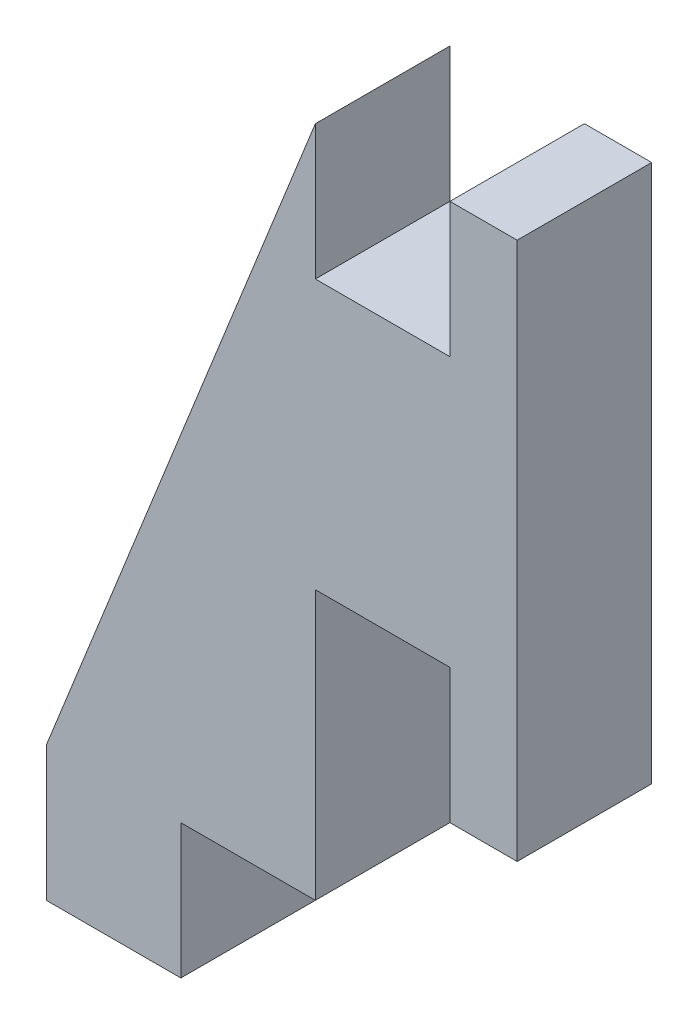
from build123d import *

# Parameters (mm, degrees)
BOSS_EXTRUDE1_DEPTH = 6.35
SKETCH2_W           = 3.175
SKETCH2_H           = 25.4
BOSS_EXTRUDE2_DEPTH = 6.35


with BuildPart() as part:
    # Sketch1 → Boss-Extrude1 (new body)
    with BuildSketch(Plane.XY):
        Polygon((0, 0), (0, 12.7), (6.35, 12.7), (6.35, 25.4), (0, 25.4), (0, 31.75), (-12.7, 0), (-12.7, -6.35), (-6.35, -6.35), (-6.35, 0), align=None)
    extrude(amount=BOSS_EXTRUDE1_DEPTH)

    # Sketch2 → Boss-Extrude2 (add)
    with BuildSketch(Plane.XY):
        with Locations((7.9375, 19.05)):
            Rectangle(SKETCH2_W, SKETCH2_H)
    extrude(amount=BOSS_EXTRUDE2_DEPTH)


solid = part.part
